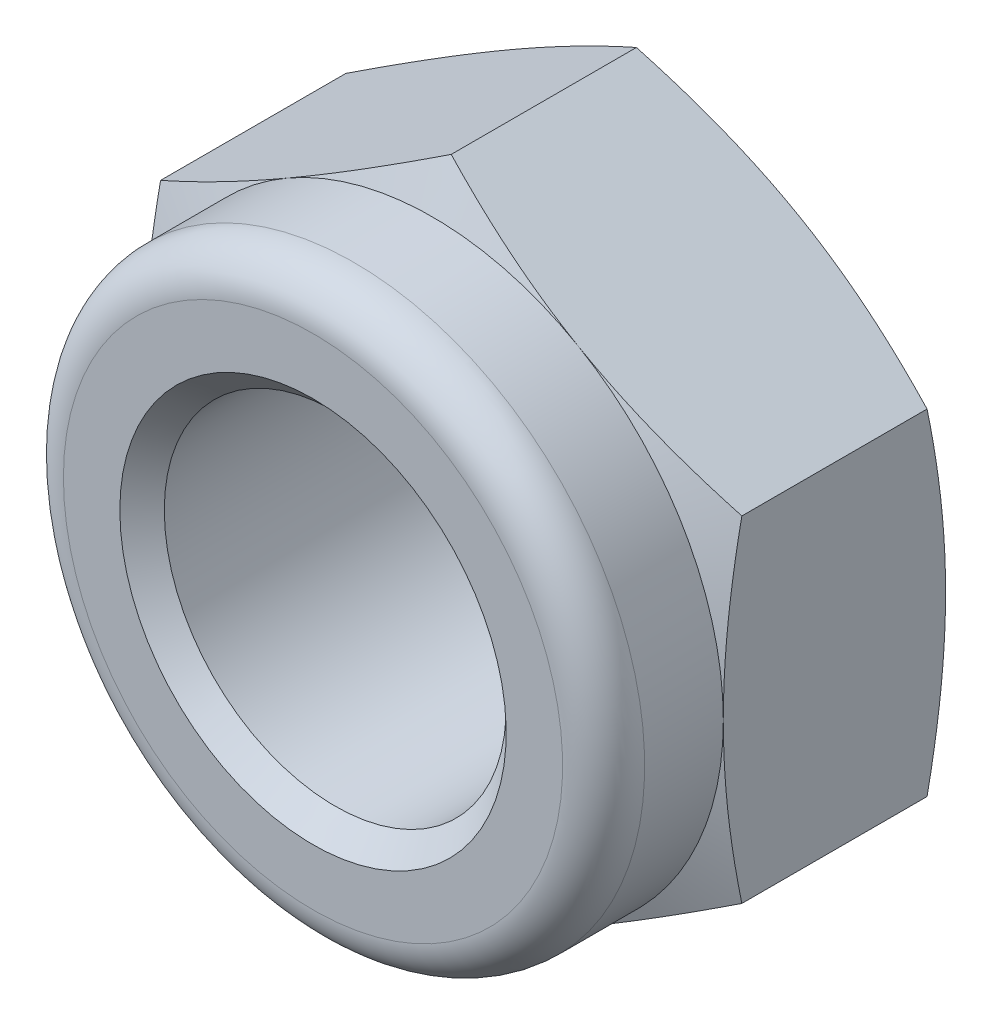
from build123d import *

# Parameters (mm, degrees)
SKETCH1_R           = 5
BOSS_EXTRUDE1_DEPTH = 6.5


with BuildPart() as part:
    # Sketch1 → Boss-Extrude1 (new body)
    with BuildSketch(Plane.XY):
        Polygon((0, -9.814954576), (8.5, -4.907477288), (8.5, 4.907477288), (0, 9.814954576), (-8.5, 4.907477288), (-8.5, -4.907477288), align=None)
        with Locations(Location((0, 0, 0), (0, 0, 180))):
            Circle(SKETCH1_R, mode=Mode.SUBTRACT)
    extrude(amount=BOSS_EXTRUDE1_DEPTH)

    # Sketch3 → Revolve1 (revolve)
    with BuildSketch(Plane(origin=(0, 0, 0), x_dir=(0, 0, -1), z_dir=(0, 1, 0))):
        with BuildLine():
            Line((-6.5, 8.5), (-8.8, 8.5))
            ThreePointArc((-8.8, 8.5), (-9.648528137, 8.148528137), (-10, 7.3))
            Line((-10, 7.3), (-10, 5))
            Line((-10, 5), (-6.5, 5))
            Line((-6.5, 5), (-6.5, 8.5))
        make_face()
    revolve(axis=Axis((0, 0, 0), (0, 0, 1)))

    # Sketch2 → Cut-Revolve1 (revolve, cut)
    with BuildSketch(Plane(origin=(0, 0, 0), x_dir=(0, 0, -1), z_dir=(1, 0, 0)), mode=Mode.PRIVATE) as cut_revolve1_sk:
        Polygon((-6.5, 9.814954576), (-6.5, 8.5), (-5.958333333, 9.814954576), align=None)
        Polygon((-0.541666667, 9.814954576), (0, 9.814954576), (0, 8.5), align=None)
        Polygon((-10, 5), (-9.35, 5), (-10, 5.65), align=None)
        Polygon((0, 5), (-0.65, 5), (0, 5.65), align=None)
    revolve(cut_revolve1_sk.sketch.rotate(Axis((0, 0, 0), (0, 0, 1)), 90), axis=Axis((0, 0, 0), (0, 0, 1)), mode=Mode.SUBTRACT)


solid = part.part
